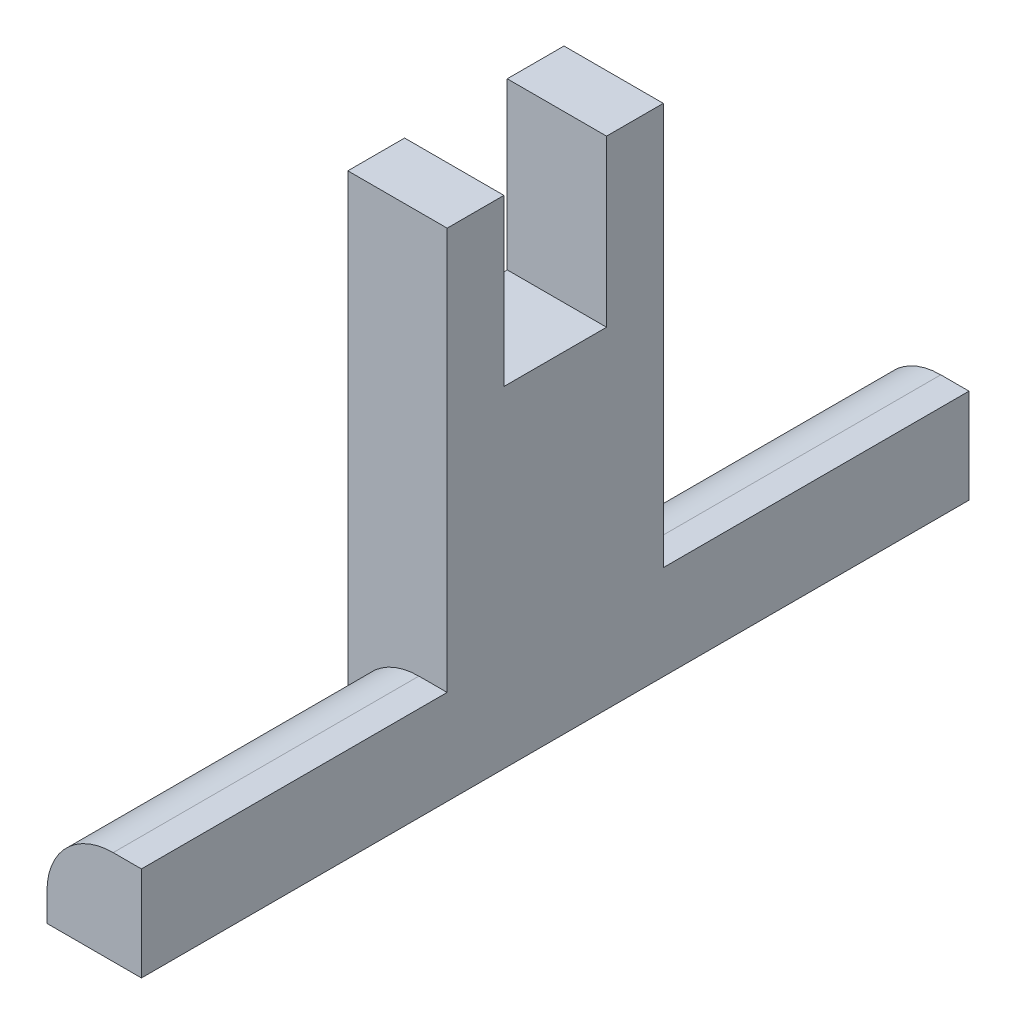
from build123d import *

# Parameters (mm, degrees)
BOSS_EXTRUDE2_DEPTH      = 6
BOSS_EXTRUDE3_DEPTH      = 18.469887
BOSS_EXTRUDE3_DEPTH_BACK = 31.530113


with BuildPart() as part:
    # Sketch1 → Boss-Extrude2 (new body)
    with BuildSketch(Plane(origin=(0, 0, 0), x_dir=(0, 0, -1), z_dir=(1, 0, 0))):
        Polygon((-3.1, 0), (-3.1, 10), (-6.530112864, 10), (-6.530112864, -20), (6.530112864, -20), (6.530112864, 10), (3.1, 10), (3.1, 0), align=None)
    extrude(amount=-BOSS_EXTRUDE2_DEPTH)

    # Sketch2 → Boss-Extrude3 (add, two sides: drawn at the far end of the back side and taken through both)
    with BuildSketch(Plane.XY.offset(6.530112864).offset(-BOSS_EXTRUDE3_DEPTH_BACK)):
        with BuildLine():
            Line((0, -20), (-5.707191464, -20))
            Line((-5.707191464, -20), (-5.707191464, -18.292808536))
            ThreePointArc((-5.707191464, -18.292808536), (-4.535618589, -15.464381411), (-1.707191464, -14.292808536))
            Line((-1.707191464, -14.292808536), (0, -14.292808536))
            Line((0, -14.292808536), (0, -20))
        make_face()
    extrude(amount=BOSS_EXTRUDE3_DEPTH + BOSS_EXTRUDE3_DEPTH_BACK)


solid = part.part
